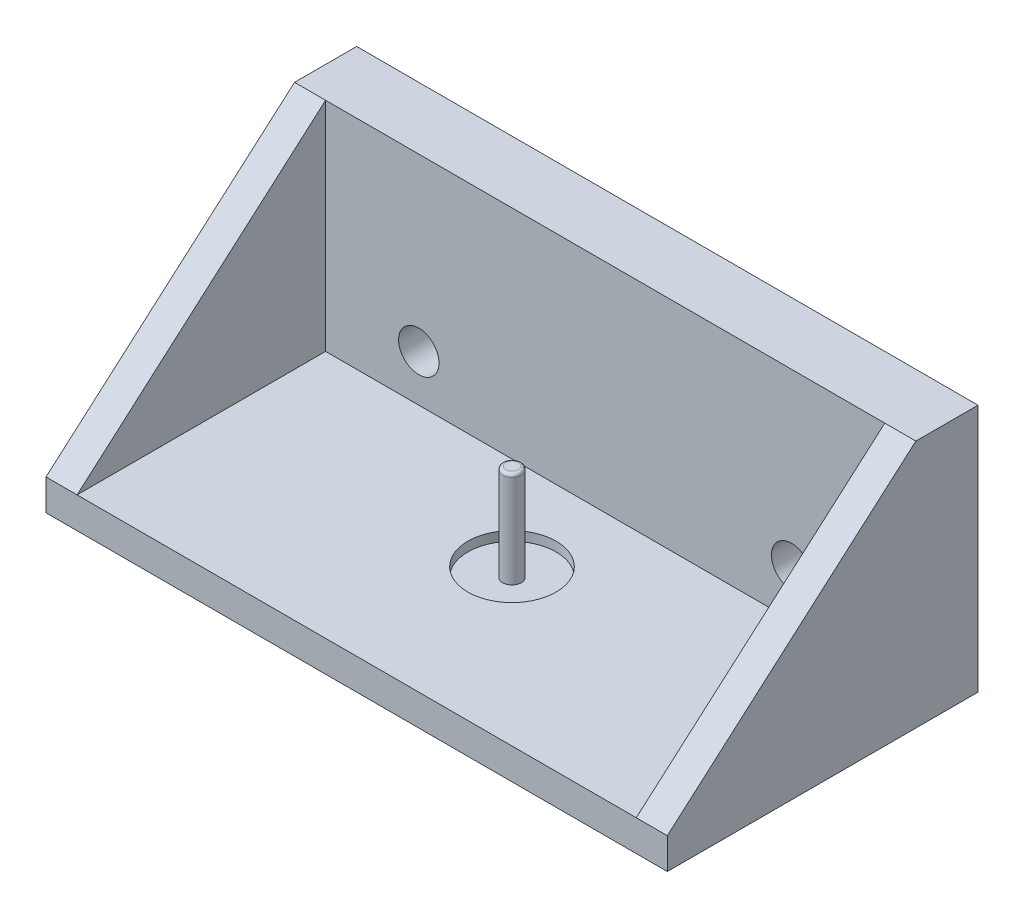
from build123d import *

# Parameters (mm, degrees)
SKETCH1_W               = 100
SKETCH1_H               = 50
BOSS_EXTRUDE1_DEPTH     = 5
SKETCH2_W               = 100
SKETCH2_H               = 10
BOSS_EXTRUDE2_DEPTH     = 40
CUT_EXTRUDE1_DEPTH      = 76.498344353
CUT_EXTRUDE1_DEPTH_BACK = 76.498344353
SKETCH4_3_R             = 3.25
CUT_EXTRUDE2_DEPTH      = 76.498344353
CUT_EXTRUDE2_DEPTH_BACK = 76.498344353
SKETCH4_R               = 3.25
BOSS_EXTRUDE5_DEPTH     = 5
SKETCH9_R               = 7.1
CUT_EXTRUDE3_DEPTH      = 1.5
SKETCH10_R              = 1.5
BOSS_EXTRUDE6_DEPTH     = 15.5
FILLET1_R               = 0.5


with BuildPart() as part:
    # Sketch1 → Boss-Extrude1 (new body)
    with BuildSketch(Plane(origin=(0, 0, 0), x_dir=(1, 0, 0), z_dir=(0, 1, 0))):
        Rectangle(SKETCH1_W, SKETCH1_H)
    extrude(amount=BOSS_EXTRUDE1_DEPTH)

    # Sketch2 → Boss-Extrude2 (add)
    with BuildSketch(Plane(origin=(0, 0, 0), x_dir=(1, 0, 0), z_dir=(0, 1, 0))):
        with Locations((0, 20)):
            Rectangle(SKETCH2_W, SKETCH2_H)
    extrude(amount=BOSS_EXTRUDE2_DEPTH)

    # Sketch4<3> → Cut-Extrude1 (cut, two sides: drawn at the far end of the back side and taken through both)
    with BuildSketch(Plane.XY.offset(-15).offset(-CUT_EXTRUDE1_DEPTH_BACK)):
        with Locations((-30, 12.5)):
            Circle(SKETCH4_3_R)
    extrude(amount=CUT_EXTRUDE1_DEPTH + CUT_EXTRUDE1_DEPTH_BACK, mode=Mode.SUBTRACT)

    # Sketch4 → Cut-Extrude2 (cut, two sides: drawn at the far end of the back side and taken through both)
    with BuildSketch(Plane.XY.offset(-15).offset(-CUT_EXTRUDE2_DEPTH_BACK)):
        with Locations((30, 12.5)):
            Circle(SKETCH4_R)
    extrude(amount=CUT_EXTRUDE2_DEPTH + CUT_EXTRUDE2_DEPTH_BACK, mode=Mode.SUBTRACT)

    # Sketch8 → Boss-Extrude5 (add)
    with BuildSketch(Plane(origin=(50, 0, 0), x_dir=(0, 0, -1), z_dir=(1, 0, 0))):
        Polygon((15, 40), (15, 5), (-25, 5), align=None)
    boss_extrude5 = extrude(amount=-BOSS_EXTRUDE5_DEPTH)

    # Mirror1: Boss-Extrude5 across plane
    add(boss_extrude5.mirror(Plane(origin=(0, 0, 0), x_dir=(0, 0, 1), z_dir=(1, 0, 0))))

    # Sketch9 → Cut-Extrude3 (cut)
    with BuildSketch(Plane(origin=(0, 5, 0), x_dir=(1, 0, 0), z_dir=(0, 1, 0))):
        Circle(SKETCH9_R)
    extrude(amount=-CUT_EXTRUDE3_DEPTH, mode=Mode.SUBTRACT)

    # Sketch10 → Boss-Extrude6 (add)
    with BuildSketch(Plane(origin=(0, 3.5, 0), x_dir=(1, 0, 0), z_dir=(0, 1, 0))):
        Circle(SKETCH10_R)
    extrude(amount=BOSS_EXTRUDE6_DEPTH)

    # Fillet1
    fillet1_edges = [part.edges().sort_by_distance(p)[0] for p in [
        (-1.5, 19, 0),
    ]]
    fillet(fillet1_edges, radius=FILLET1_R)


solid = part.part
